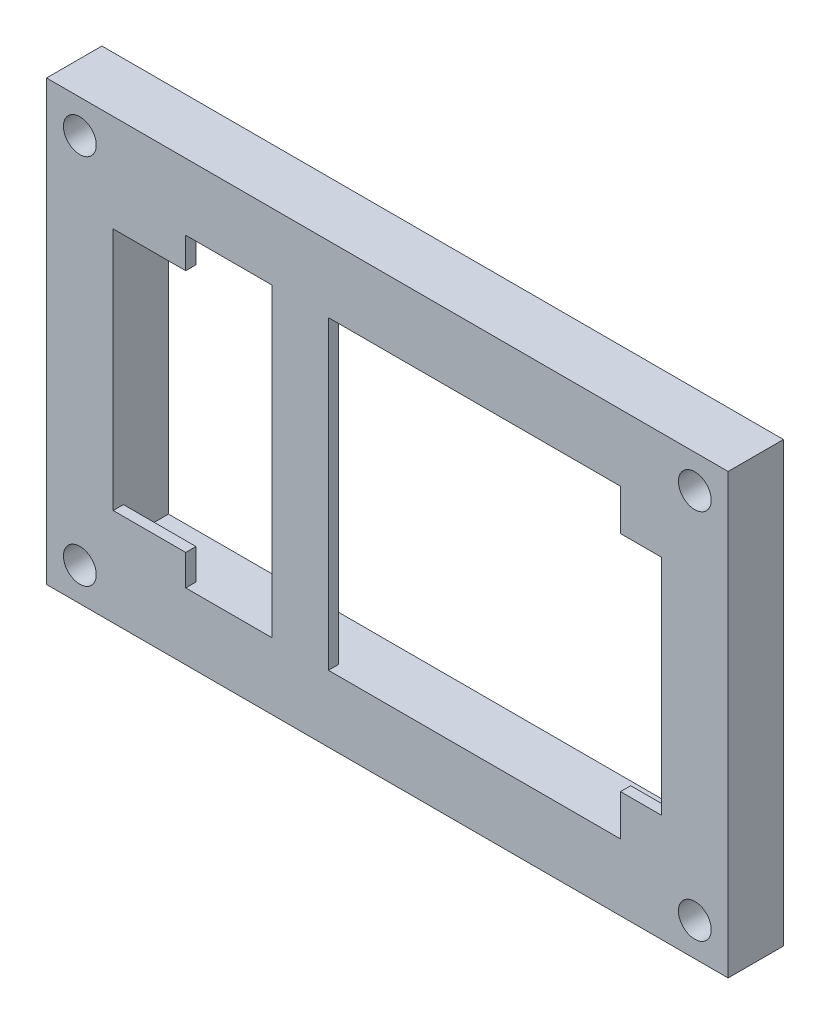
from build123d import *

# Parameters (mm, degrees)
SZKIC1_W                    = 66.5
SZKIC1_H                    = 42.8
DODANIE_WYCI_GNI_CIE1_DEPTH = 5.4
SZKIC2_W                    = 53.5
SZKIC2_H                    = 29.8
WYTNIJ_WYCI_GNI_CIE1_DEPTH  = 120.279744778
SZKIC3_R                    = 1.6
WYTNIJ_WYCI_GNI_CIE2_DEPTH  = 10
SZKIC5_W                    = 5.5
SZKIC5_H                    = 1
DODANIE_WYCI_GNI_CIE2_DEPTH = 29.8
SZKIC6_W                    = 4
SZKIC6_H                    = 1
DODANIE_WYCI_GNI_CIE3_DEPTH = 4
SZKIC7_W                    = 4
SZKIC7_H                    = 1
DODANIE_WYCI_GNI_CIE4_DEPTH = 4
SZKIC8_W                    = 7.080014019
SZKIC8_H                    = 1
DODANIE_WYCI_GNI_CIE5_DEPTH = 3
SZKIC9_W                    = 7.08
SZKIC9_H                    = 1
DODANIE_WYCI_GNI_CIE6_DEPTH = 3


with BuildPart() as part:
    # Szkic1 → Dodanie-wyciągnięcie1 (new body)
    with BuildSketch(Plane.XY):
        with Locations((-69.098753826, 39.618276807)):
            Rectangle(SZKIC1_W, SZKIC1_H)
    extrude(amount=DODANIE_WYCI_GNI_CIE1_DEPTH)

    # Szkic2 → Wytnij-wyciągnięcie1 (cut, through all)
    with BuildSketch(Plane.XY.offset(5.4)):
        with Locations((-69.098753826, 39.618276807)):
            Rectangle(SZKIC2_W, SZKIC2_H)
    extrude(amount=-WYTNIJ_WYCI_GNI_CIE1_DEPTH, mode=Mode.SUBTRACT)

    # Szkic3 → Wytnij-wyciągnięcie2 (cut)
    with BuildSketch(Plane.XY.offset(5.4)):
        with Locations((-99.098753826, 57.768276807)):
            Circle(SZKIC3_R)
        with Locations((-39.098753826, 57.768276807)):
            Circle(SZKIC3_R)
        with Locations((-39.098753826, 21.468276807)):
            Circle(SZKIC3_R)
        with Locations((-99.098753826, 21.468276807)):
            Circle(SZKIC3_R)
    extrude(amount=-WYTNIJ_WYCI_GNI_CIE2_DEPTH, mode=Mode.SUBTRACT)

    # Szkic5 → Dodanie-wyciągnięcie2 (add)
    with BuildSketch(Plane.XZ.offset(-54.518276807)):
        with Locations((-77.598753826, 4.9)):
            Rectangle(SZKIC5_W, SZKIC5_H)
    extrude(amount=DODANIE_WYCI_GNI_CIE2_DEPTH)

    # Szkic6 → Dodanie-wyciągnięcie3 (add)
    with BuildSketch(Plane.XZ.offset(-54.518276807)):
        with Locations((-44.348753826, 4.9)):
            Rectangle(SZKIC6_W, SZKIC6_H)
    extrude(amount=DODANIE_WYCI_GNI_CIE3_DEPTH)

    # Szkic7 → Dodanie-wyciągnięcie4 (add)
    with BuildSketch(Plane(origin=(0, 24.718276807, 0), x_dir=(1, 0, 0), z_dir=(0, 1, 0))):
        with Locations((-44.348753826, -4.9)):
            Rectangle(SZKIC7_W, SZKIC7_H)
    extrude(amount=DODANIE_WYCI_GNI_CIE4_DEPTH)

    # Szkic8 → Dodanie-wyciągnięcie5 (add)
    with BuildSketch(Plane.XZ.offset(-54.518276807)):
        with Locations((-92.308746817, 4.9)):
            Rectangle(SZKIC8_W, SZKIC8_H)
    extrude(amount=DODANIE_WYCI_GNI_CIE5_DEPTH)

    # Szkic9 → Dodanie-wyciągnięcie6 (add)
    with BuildSketch(Plane(origin=(0, 24.718276807, 0), x_dir=(1, 0, 0), z_dir=(0, 1, 0))):
        with Locations((-92.308753826, -4.9)):
            Rectangle(SZKIC9_W, SZKIC9_H)
    extrude(amount=DODANIE_WYCI_GNI_CIE6_DEPTH)


solid = part.part
